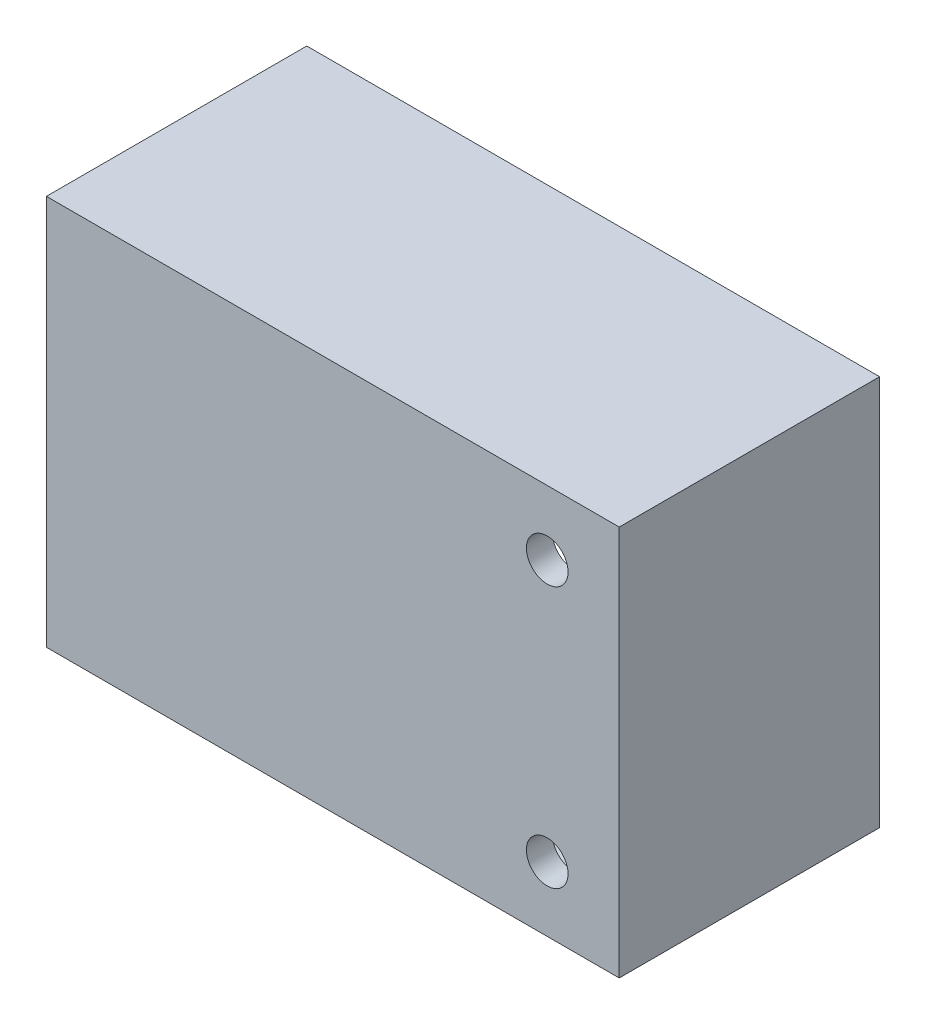
from build123d import *

# Parameters (mm, degrees)
ESBO_O1_W                = 44
ESBO_O1_H                = 30
ESBO_O1_W_2              = 40
ESBO_O1_H_2              = 26
RESSALTO_EXTRUS_O1_DEPTH = 20
ESBO_O3_W                = 15
ESBO_O3_H                = 26
CORTE_EXTRUS_O1_DEPTH    = 20
ESBO_O4_W                = 44
ESBO_O4_H                = 30
RESSALTO_EXTRUS_O2_DEPTH = 2
ESBO_O5_R                = 1.6
CORTE_EXTRUS_O2_DEPTH    = 2


with BuildPart() as part:
    # Esboço1 → Ressalto-extrusão1 (new body)
    with BuildSketch(Plane.XY):
        with Locations((22, 15)):
            Rectangle(ESBO_O1_W, ESBO_O1_H)
        with Locations((22, 15)):
            Rectangle(ESBO_O1_W_2, ESBO_O1_H_2, mode=Mode.SUBTRACT)
    extrude(amount=RESSALTO_EXTRUS_O1_DEPTH)

    # Esboço3 → Corte-extrusão1 (cut)
    with BuildSketch(Plane.ZY):
        with Locations((7.5, 15)):
            Rectangle(ESBO_O3_W, ESBO_O3_H)
    extrude(amount=-CORTE_EXTRUS_O1_DEPTH, mode=Mode.SUBTRACT)

    # Esboço4 → Ressalto-extrusão2 (add)
    with BuildSketch(Plane.XY.offset(20)):
        with Locations((22, 15)):
            Rectangle(ESBO_O4_W, ESBO_O4_H)
    extrude(amount=-RESSALTO_EXTRUS_O2_DEPTH)

    # Esboço5 → Corte-extrusão2 (cut)
    with BuildSketch(Plane.XY.offset(20)):
        with Locations((38.47, 25.04)):
            Circle(ESBO_O5_R)
        with Locations(Location((38.47, 4.96, 0), (0, 0, 180))):
            Circle(ESBO_O5_R)
    extrude(amount=-CORTE_EXTRUS_O2_DEPTH, mode=Mode.SUBTRACT)


solid = part.part
